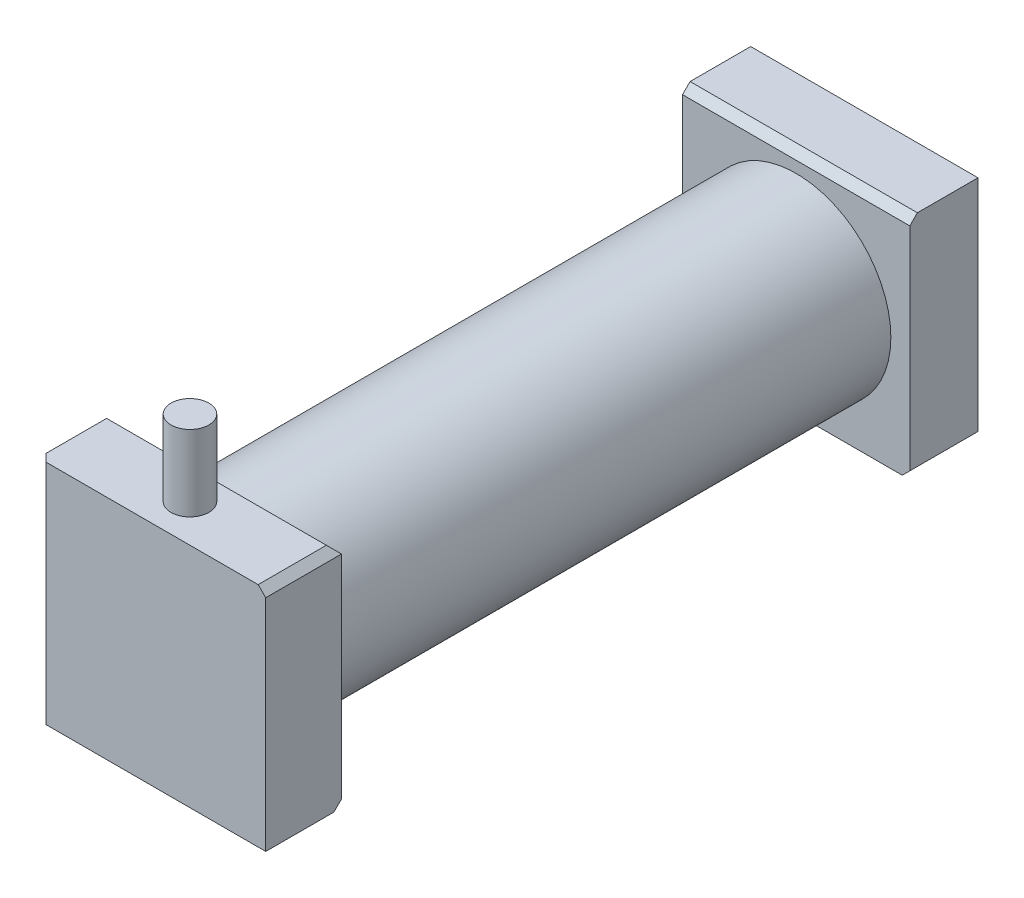
from build123d import *

# Parameters (mm, degrees)
SKETCH1_R            = 25
BOSS_EXTRUDE1_DEPTH  = 150
SKETCH2_W            = 60
SKETCH2_H            = 60
BOSS_EXTRUDE2_DEPTH  = 20
SKETCH3_W            = 60
SKETCH3_H            = 60
BOSS_EXTRUDE3_DEPTH  = 20
SKETCH4_R            = 5
CUT_EXTRUDE1_DEPTH   = 20
SKETCH5_R            = 5
BOSS_EXTRUDE4_DEPTH  = 20
CHAMFER1_SIZE        = 2
CHAMFER2_SIZE        = 2
SKETCH6_R            = 25
BOSS_EXTRUDE5_DEPTH  = 150
SKETCH7_W            = 60
SKETCH7_H            = 60
BOSS_EXTRUDE6_DEPTH  = 20
SKETCH8_W            = 60
SKETCH8_H            = 60
BOSS_EXTRUDE7_DEPTH  = 20
SKETCH9_R            = 5
CUT_EXTRUDE2_DEPTH   = 20
SKETCH10_R           = 5
BOSS_EXTRUDE8_DEPTH  = 20
CHAMFER3_SIZE        = 2
CHAMFER4_SIZE        = 2
SKETCH11_R           = 25
BOSS_EXTRUDE9_DEPTH  = 150
SKETCH12_W           = 60
SKETCH12_H           = 60
BOSS_EXTRUDE10_DEPTH = 20
SKETCH13_W           = 60
SKETCH13_H           = 60
BOSS_EXTRUDE11_DEPTH = 20
SKETCH14_R           = 5
CUT_EXTRUDE3_DEPTH   = 20
SKETCH15_R           = 5
BOSS_EXTRUDE12_DEPTH = 20
CHAMFER5_SIZE        = 2
CHAMFER6_SIZE        = 2


with BuildPart() as part:
    # Sketch1 → Boss-Extrude1 (new body)
    with BuildSketch(Plane.XY):
        Circle(SKETCH1_R)
    extrude(amount=BOSS_EXTRUDE1_DEPTH)

    # Sketch2 → Boss-Extrude2 (add)
    with BuildSketch(Plane.XY):
        Rectangle(SKETCH2_W, SKETCH2_H)
    extrude(amount=-BOSS_EXTRUDE2_DEPTH)

    # Sketch3 → Boss-Extrude3 (add)
    with BuildSketch(Plane.XY.offset(150)):
        Rectangle(SKETCH3_W, SKETCH3_H)
    extrude(amount=BOSS_EXTRUDE3_DEPTH)

    # Sketch4 → Cut-Extrude1 (cut)
    with BuildSketch(Plane(origin=(0, -30, 0), x_dir=(1, 0, 0), z_dir=(0, 1, 0))):
        with Locations((0, 10)):
            Circle(SKETCH4_R)
    extrude(amount=CUT_EXTRUDE1_DEPTH, mode=Mode.SUBTRACT)

    # Sketch5 → Boss-Extrude4 (add)
    with BuildSketch(Plane(origin=(0, 30, 0), x_dir=(1, 0, 0), z_dir=(0, 1, 0))):
        with Locations((0, -160)):
            Circle(SKETCH5_R)
    extrude(amount=BOSS_EXTRUDE4_DEPTH)

    # Chamfer1
    chamfer1_edges = [part.edges().sort_by_distance(p)[0] for p in [
        (-30, -30, -10),
        (-30, 30, -10),
        (30, -30, -10),
        (30, 0, -20),
    ]]
    chamfer(chamfer1_edges, length=CHAMFER1_SIZE)

    # Chamfer2
    chamfer2_edges = [part.edges().sort_by_distance(p)[0] for p in [
        (30, 30, 160),
        (0, -30, 150),
        (-30, 0, 170),
        (-30, 30, 160),
    ]]
    chamfer(chamfer2_edges, length=CHAMFER2_SIZE)

    # Sketch6 → Boss-Extrude5 (add)
    with BuildSketch(Plane.XY):
        Circle(SKETCH6_R)
    extrude(amount=BOSS_EXTRUDE5_DEPTH)

    # Sketch7 → Boss-Extrude6 (add)
    with BuildSketch(Plane.XY):
        Rectangle(SKETCH7_W, SKETCH7_H)
    extrude(amount=-BOSS_EXTRUDE6_DEPTH)

    # Sketch8 → Boss-Extrude7 (add)
    with BuildSketch(Plane.XY.offset(150)):
        Rectangle(SKETCH8_W, SKETCH8_H)
    extrude(amount=BOSS_EXTRUDE7_DEPTH)

    # Sketch9 → Cut-Extrude2 (cut)
    with BuildSketch(Plane(origin=(0, -30, 0), x_dir=(1, 0, 0), z_dir=(0, 1, 0))):
        with Locations((0, 10)):
            Circle(SKETCH9_R)
    extrude(amount=CUT_EXTRUDE2_DEPTH, mode=Mode.SUBTRACT)

    # Sketch10 → Boss-Extrude8 (add)
    with BuildSketch(Plane(origin=(0, 30, 0), x_dir=(1, 0, 0), z_dir=(0, 1, 0))):
        with Locations((0, -160)):
            Circle(SKETCH10_R)
    extrude(amount=BOSS_EXTRUDE8_DEPTH)

    # Chamfer3
    chamfer3_edges = [part.edges().sort_by_distance(p)[0] for p in [
        (30, -30, -10),
        (-30, 0, -20),
        (0, -30, -20),
        (30, 0, -20),
        (-30, 0, 0),
    ]]
    chamfer(chamfer3_edges, length=CHAMFER3_SIZE)

    # Chamfer4
    chamfer4_edges = [part.edges().sort_by_distance(p)[0] for p in [
        (0, 30, 170),
        (30, 30, 160),
        (0, -30, 150),
        (-30, 0, 150),
    ]]
    chamfer(chamfer4_edges, length=CHAMFER4_SIZE)

    # Sketch11 → Boss-Extrude9 (add)
    with BuildSketch(Plane.XY):
        Circle(SKETCH11_R)
    extrude(amount=BOSS_EXTRUDE9_DEPTH)

    # Sketch12 → Boss-Extrude10 (add)
    with BuildSketch(Plane.XY):
        Rectangle(SKETCH12_W, SKETCH12_H)
    extrude(amount=-BOSS_EXTRUDE10_DEPTH)

    # Sketch13 → Boss-Extrude11 (add)
    with BuildSketch(Plane.XY.offset(150)):
        Rectangle(SKETCH13_W, SKETCH13_H)
    extrude(amount=BOSS_EXTRUDE11_DEPTH)

    # Sketch14 → Cut-Extrude3 (cut)
    with BuildSketch(Plane(origin=(0, -30, 0), x_dir=(1, 0, 0), z_dir=(0, 1, 0))):
        with Locations((0, 10)):
            Circle(SKETCH14_R)
    extrude(amount=CUT_EXTRUDE3_DEPTH, mode=Mode.SUBTRACT)

    # Sketch15 → Boss-Extrude12 (add)
    with BuildSketch(Plane(origin=(0, 30, 0), x_dir=(1, 0, 0), z_dir=(0, 1, 0))):
        with Locations((0, -160)):
            Circle(SKETCH15_R)
    extrude(amount=BOSS_EXTRUDE12_DEPTH)

    # Chamfer5
    chamfer5_edges = [part.edges().sort_by_distance(p)[0] for p in [
        (-30, -30, -10),
        (30, -30, -10),
        (0, 30, -20),
        (30, 0, -20),
        (0, 30, 0),
    ]]
    chamfer(chamfer5_edges, length=CHAMFER5_SIZE)

    # Chamfer6
    chamfer6_edges = [part.edges().sort_by_distance(p)[0] for p in [
        (-30, 0, 170),
        (30, 30, 160),
        (0, -30, 150),
        (-30, 0, 150),
        (0, 30, 150),
    ]]
    chamfer(chamfer6_edges, length=CHAMFER6_SIZE)


solid = part.part
